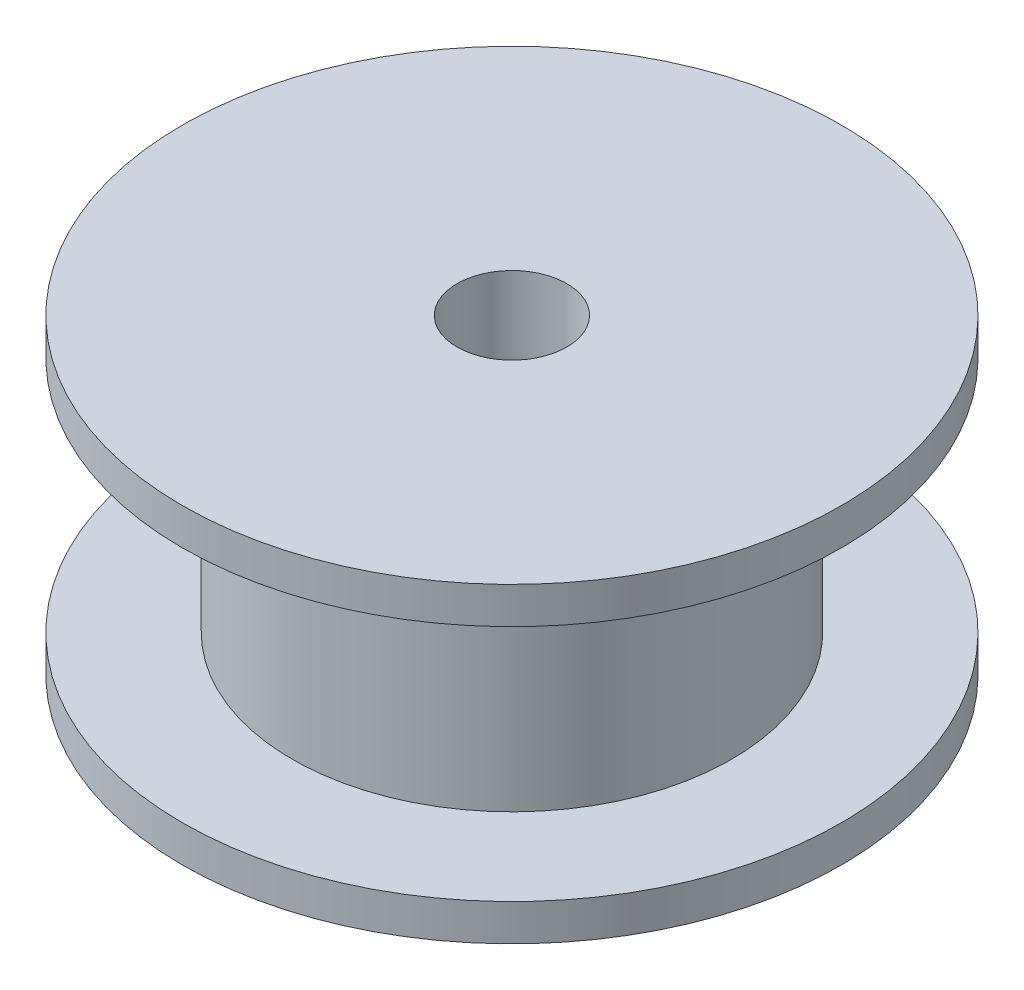
from build123d import *

# Parameters (mm, degrees)
SKETCH_1_R          = 9
EXTRUDE_1_DEPTH     = 1
SKETCH_2_R          = 6
EXTRUDE_2_DEPTH     = 6.5
SKETCH_3_R          = 9
EXTRUDE_3_DEPTH     = 1
SKETCH_4_R          = 1.5
CUT_EXTRUDE_1_DEPTH = 16.305227865


with BuildPart() as part:
    # 草图1 → 凸台-拉伸1 (new body)
    with BuildSketch(Plane(origin=(0, 0, 0), x_dir=(1, 0, 0), z_dir=(0, 1, 0))):
        with Locations(Location((0, 0, 0), (0, 0, 270))):
            Circle(SKETCH_1_R)
    extrude(amount=EXTRUDE_1_DEPTH)

    # 草图2 → 凸台-拉伸2 (add)
    with BuildSketch(Plane(origin=(0, 1, 0), x_dir=(1, 0, 0), z_dir=(0, 1, 0))):
        with Locations(Location((0, 0, 0), (0, 0, 90))):
            Circle(SKETCH_2_R)
    extrude(amount=EXTRUDE_2_DEPTH)

    # 草图3 → 凸台-拉伸3 (add)
    with BuildSketch(Plane(origin=(0, 7.5, 0), x_dir=(1, 0, 0), z_dir=(0, 1, 0))):
        with Locations(Location((0, 0, 0), (0, 0, 270))):
            Circle(SKETCH_3_R)
    extrude(amount=EXTRUDE_3_DEPTH)

    # 草图4 → 切除-拉伸1 (cut, through all)
    with BuildSketch(Plane(origin=(0, 8.5, 0), x_dir=(1, 0, 0), z_dir=(0, 1, 0))):
        with Locations(Location((0, 0, 0), (0, 0, 270))):
            Circle(SKETCH_4_R)
    extrude(amount=-CUT_EXTRUDE_1_DEPTH, mode=Mode.SUBTRACT)


solid = part.part
